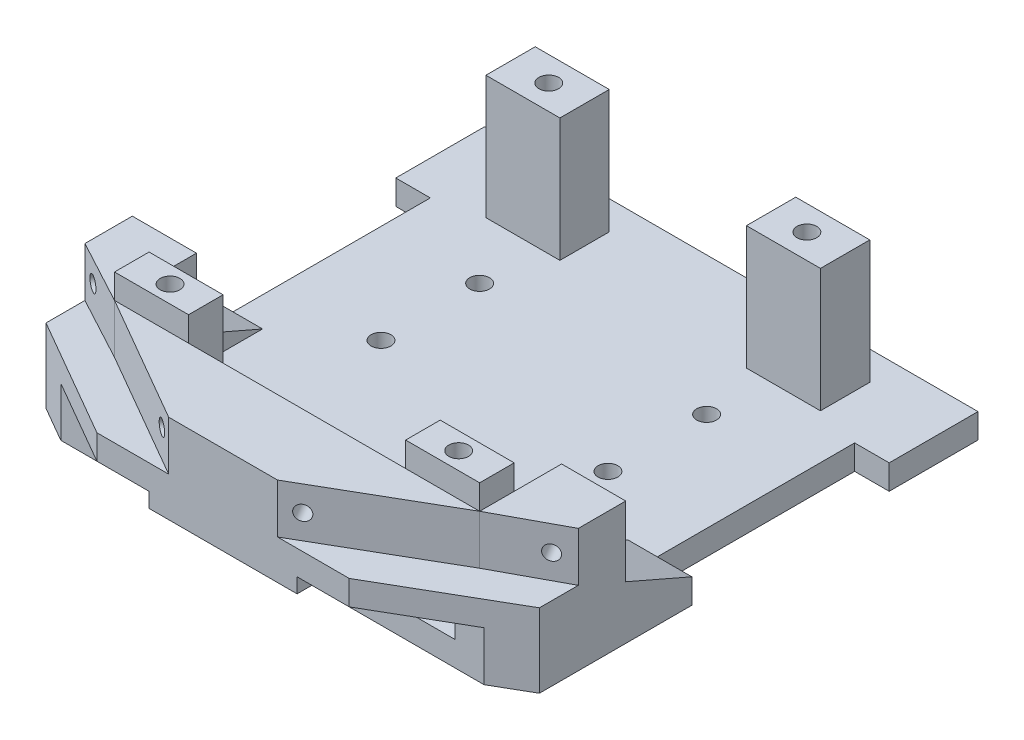
from build123d import *

# Parameters (mm, degrees)
SKETCH1_R                = 2
BOSS_EXTRUDE1_DEPTH      = 5
SKETCH3_W                = 15
SKETCH3_H                = 7
SKETCH3_H_2              = 10
BOSS_EXTRUDE3_DEPTH      = 25
SKETCH4_R                = 2
CUT_EXTRUDE1_DEPTH       = 6
SKETCH8_W                = 45
SKETCH8_H                = 10
BOSS_EXTRUDE7_DEPTH      = 13
SKETCH17_W               = 100
SKETCH17_H               = 15
BOSS_EXTRUDE11_DEPTH     = 5
BOSS_EXTRUDE12_DEPTH     = 10
SKETCH19_W               = 13
SKETCH19_H               = 5
CUT_EXTRUDE7_DEPTH       = 10
CUT_EXTRUDE8_DEPTH       = 20
CUT_EXTRUDE9_DEPTH       = 120
BOSS_EXTRUDE13_DEPTH     = 20
CUT_EXTRUDE10_DEPTH      = 10
CUT_EXTRUDE10_DEPTH_BACK = 10
SKETCH22_R               = 1.5
CUT_EXTRUDE11_DEPTH      = 10
CUT_EXTRUDE11_DEPTH_BACK = 10
SKETCH24_R               = 1.5
SKETCH25_W               = 30
SKETCH25_H               = 10
BOSS_EXTRUDE14_DEPTH     = 3


with BuildPart() as part:
    # Sketch1 → Boss-Extrude1 (new body)
    with BuildSketch(Plane(origin=(0, 0, 0), x_dir=(1, 0, 0), z_dir=(0, 1, 0))):
        Polygon((-50, 40), (50, 40), (50, 22), (43, 22), (43, -18), (50, -18), (50, -53), (35, -53), (-35, -53), (-50, -53), (-50, -18), (-43, -18), (-43, 22), (-50, 22), align=None)
        with Locations((-23, 12)):
            Circle(SKETCH1_R, mode=Mode.SUBTRACT)
        with Locations((-23, -8)):
            Circle(SKETCH1_R, mode=Mode.SUBTRACT)
        with Locations((23, -8)):
            Circle(SKETCH1_R, mode=Mode.SUBTRACT)
        with Locations((23, 12)):
            Circle(SKETCH1_R, mode=Mode.SUBTRACT)
    extrude(amount=BOSS_EXTRUDE1_DEPTH)

    # Sketch3 → Boss-Extrude3 (add)
    with BuildSketch(Plane(origin=(0, 5, 0), x_dir=(1, 0, 0), z_dir=(0, 1, 0))):
        with Locations((-29.5, -44.5)):
            Rectangle(SKETCH3_W, SKETCH3_H)
        with Locations((-26.401946621, 29.165492724)):
            Rectangle(SKETCH3_W, SKETCH3_H_2)
        with Locations((29.5, -44.5)):
            Rectangle(SKETCH3_W, SKETCH3_H)
        with Locations((26.401946621, 29.165492724)):
            Rectangle(SKETCH3_W, SKETCH3_H_2)
    extrude(amount=BOSS_EXTRUDE3_DEPTH)

    # Sketch4 → Cut-Extrude1 (cut)
    with BuildSketch(Plane(origin=(0, 30, 0), x_dir=(1, 0, 0), z_dir=(0, 1, 0))):
        with Locations((-29.25, -44.5)):
            Circle(SKETCH4_R)
        with Locations((29.25, -44.5)):
            Circle(SKETCH4_R)
        with Locations((-26.151946621, 29.165492724)):
            Circle(SKETCH4_R)
        with Locations((26.151946621, 29.165492724)):
            Circle(SKETCH4_R)
    extrude(amount=-CUT_EXTRUDE1_DEPTH, mode=Mode.SUBTRACT)

    # Sketch8 → Boss-Extrude7 (add)
    with BuildSketch(Plane.ZY.offset(37)):
        with Locations((40.5, 10)):
            Rectangle(SKETCH8_W, SKETCH8_H)
    extrude(amount=BOSS_EXTRUDE7_DEPTH)

    # Mirror2: part across plane


with BuildPart() as part_1:
    add(part.part)
    add(part.part.mirror(Plane(origin=(0, 0, 0), x_dir=(0, 0, 1), z_dir=(1, 0, 0))))

    # Sketch17 → Boss-Extrude11 (add)
    with BuildSketch(Plane(origin=(0, 15, 0), x_dir=(1, 0, 0), z_dir=(0, 1, 0))):
        with Locations((0, -55.5)):
            Rectangle(SKETCH17_W, SKETCH17_H)
    extrude(amount=-BOSS_EXTRUDE11_DEPTH)

    # Sketch18 → Boss-Extrude12 (add)
    with BuildSketch(Plane(origin=(0, 15, 0), x_dir=(1, 0, 0), z_dir=(0, 1, 0))):
        Polygon((-37, -48), (-11.02885683, -63), (11.02885683, -63), (37, -48), align=None)
    extrude(amount=BOSS_EXTRUDE12_DEPTH)

    # Sketch19 → Cut-Extrude7 (cut)
    with BuildSketch(Plane.XY.offset(63)):
        with Locations((-43.5, 7.5)):
            Rectangle(SKETCH19_W, SKETCH19_H)
        with Locations((43.5, 7.5)):
            Rectangle(SKETCH19_W, SKETCH19_H)
    extrude(amount=-CUT_EXTRUDE7_DEPTH, mode=Mode.SUBTRACT)

    # Sketch20 → Cut-Extrude8 (cut)
    with BuildSketch(Plane(origin=(0, 15, 0), x_dir=(1, 0, 0), z_dir=(0, 1, 0))):
        Polygon((-25.568008611, -63), (-50, -48.888958818), (-50, -63), align=None)
        Polygon((50, -48.888958818), (50, -63), (25.568008611, -63), align=None)
    extrude(amount=-CUT_EXTRUDE8_DEPTH, mode=Mode.SUBTRACT)

    # Sketch21 → Cut-Extrude9 (cut)
    with BuildSketch(Plane(origin=(50, 0, 0), x_dir=(0, 0, -1), z_dir=(1, 0, 0))):
        Polygon((-41, 15), (-18, 5), (-18, 15), align=None)
    extrude(amount=-CUT_EXTRUDE9_DEPTH, mode=Mode.SUBTRACT)

    # Sketch23 → Boss-Extrude13 (add)
    with BuildSketch(Plane(origin=(0, 25, 0), x_dir=(1, 0, 0), z_dir=(0, 1, 0))):
        Polygon((-37, -48), (-50, -41), (-50, -31.394208948), (-37, -31.394208948), align=None)
        Polygon((50, -31.394208948), (37, -31.394208948), (37, -48), (50, -41), align=None)
    extrude(amount=-BOSS_EXTRUDE13_DEPTH)

    # Sketch22 → Cut-Extrude10 (cut, two sides: drawn at the far end of the back side and taken through both)
    with BuildSketch(Plane(origin=(-30.043596157, 0, 52.017769143), x_dir=(0.8659452125260777, 0, 0.5001388696183953), z_dir=(-0.5001388696183953, 0, 0.8659452125260777)).offset(-CUT_EXTRUDE10_DEPTH_BACK)):
        with Locations((-18.791636985, 20.670945853)):
            Circle(SKETCH22_R)
        with Locations((18.208363015, 20.670945853)):
            Circle(SKETCH22_R)
    extrude(amount=CUT_EXTRUDE10_DEPTH + CUT_EXTRUDE10_DEPTH_BACK, mode=Mode.SUBTRACT)

    # Sketch24 → Cut-Extrude11 (cut, two sides: drawn at the far end of the back side and taken through both)
    with BuildSketch(Plane(origin=(30.043596157, 0, 52.017769143), x_dir=(0.8659452125260774, 0, -0.5001388696183958), z_dir=(0.5001388696183958, 0, 0.8659452125260774)).offset(-CUT_EXTRUDE11_DEPTH_BACK)):
        with Locations((-18.208363015, 19.924140623)):
            Circle(SKETCH24_R)
        with Locations((18.791636985, 19.924140623)):
            Circle(SKETCH24_R)
    extrude(amount=CUT_EXTRUDE11_DEPTH + CUT_EXTRUDE11_DEPTH_BACK, mode=Mode.SUBTRACT)

    # Sketch25 → Boss-Extrude14 (add)
    with BuildSketch(Plane.XZ.offset(-10)):
        with Locations((0, 58)):
            Rectangle(SKETCH25_W, SKETCH25_H)
    extrude(amount=BOSS_EXTRUDE14_DEPTH)


solid = part_1.part
